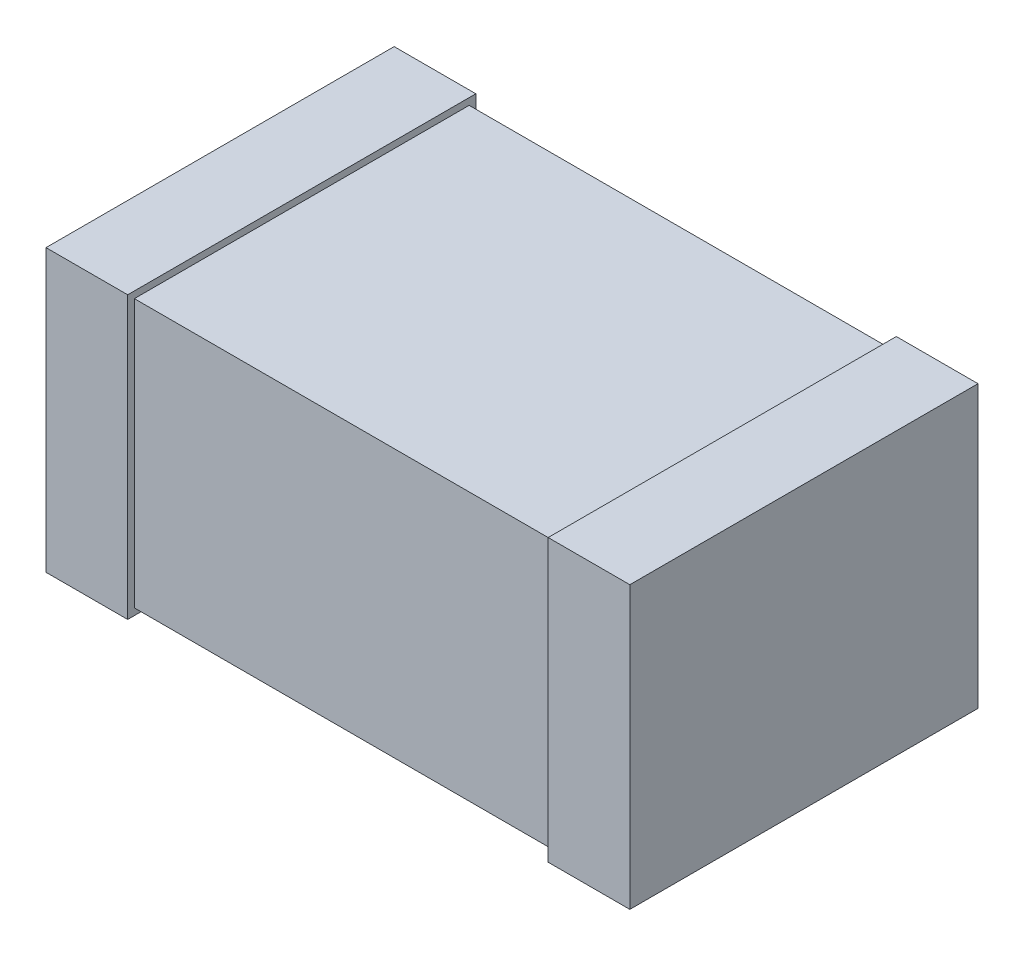
from build123d import *

# Parameters (mm, degrees)
SKETCH1_W           = 3.2
SKETCH1_H           = 2.5
BOSS_EXTRUDE1_DEPTH = 2
BOSS_EXTRUDE2_START = -0.03
SKETCH2_W           = 2.6
SKETCH2_H           = 2.1
BOSS_EXTRUDE2_DEPTH = 0.61


with BuildPart() as part:
    # Sketch1 → Boss-Extrude1 (new body)
    with BuildSketch(Plane(origin=(0, 0, 0), x_dir=(1, 0, 0), z_dir=(0, 1, 0))):
        Rectangle(SKETCH1_W, SKETCH1_H)
    extrude(amount=BOSS_EXTRUDE1_DEPTH)

    # Sketch2 → Boss-Extrude2 (add)
    with BuildSketch(Plane(origin=(1.6, 0, 0), x_dir=(0, 0, -1), z_dir=(1, 0, 0)).offset(BOSS_EXTRUDE2_START)):
        with Locations((0, 1)):
            Rectangle(SKETCH2_W, SKETCH2_H)
    boss_extrude2 = extrude(amount=BOSS_EXTRUDE2_DEPTH)

    # Mirror1: Boss-Extrude2 across plane
    add(boss_extrude2.mirror(Plane(origin=(0, 0, 0), x_dir=(0, 0, 1), z_dir=(1, 0, 0))))


solid = part.part
